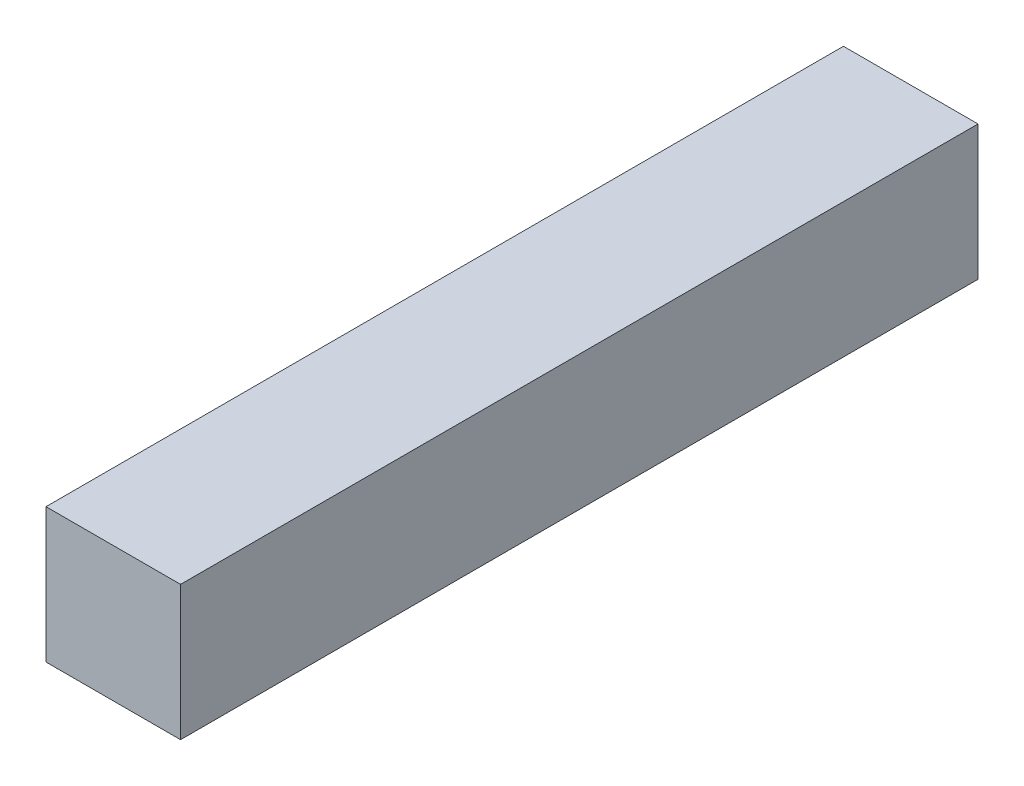
from build123d import *

# Parameters (mm, degrees)
SKETCH1_W           = 30
SKETCH1_H           = 30
BOSS_EXTRUDE1_DEPTH = 177.8


with BuildPart() as part:
    # Sketch1 → Boss-Extrude1 (new body)
    with BuildSketch(Plane.XY):
        Rectangle(SKETCH1_W, SKETCH1_H)
    extrude(amount=BOSS_EXTRUDE1_DEPTH)


solid = part.part
